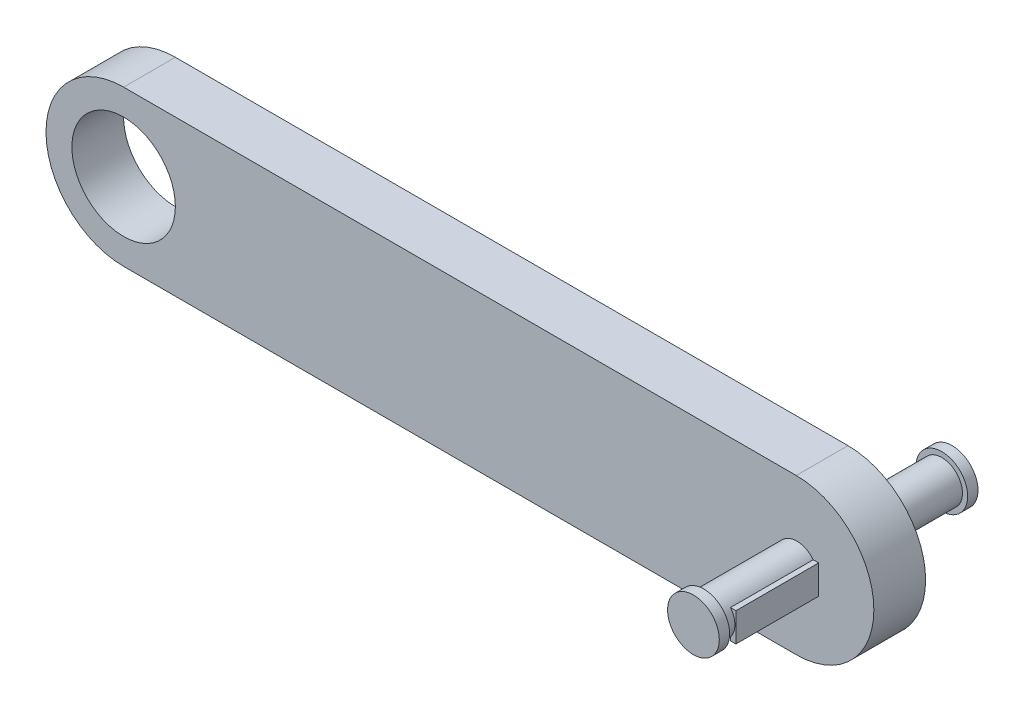
from build123d import *

# Parameters (mm, degrees)
SKETCH1_R                = 6.35
BOSS_EXTRUDE1_DEPTH      = 6.35
BOSS_EXTRUDE2_DEPTH      = 12.7
BOSS_EXTRUDE2_DEPTH_BACK = 19.05
SKETCH2_R                = 3.175
CUT_EXTRUDE1_START       = -1.27
SKETCH9_OUTSIDE_W        = 125.228
SKETCH9_OUTSIDE_H        = 42.678
SKETCH9_OUTSIDE_R        = 2.547934527
CUT_EXTRUDE1_DEPTH       = 11.43
CUT_EXTRUDE2_START       = -1.27
SKETCH10_OUTSIDE_W       = 125.228
SKETCH10_OUTSIDE_H       = 42.678
SKETCH10_OUTSIDE_R       = 2.542549773
CUT_EXTRUDE2_DEPTH       = 11.43
SKETCH11_W               = 0.667064712
SKETCH11_H               = 3.541255891
BOSS_EXTRUDE3_DEPTH      = 10.16


with BuildPart() as part:
    # Sketch1 → Boss-Extrude1 (new body)
    with BuildSketch(Plane.XY):
        with BuildLine():
            Line((-75.85152439, 14.055182927), (6.69847561, 14.055182927))
            ThreePointArc((6.69847561, 14.055182927), (16.22347561, 4.530182927), (6.69847561, -4.994817073))
            Line((6.69847561, -4.994817073), (-75.85152439, -4.994817073))
            ThreePointArc((-75.85152439, -4.994817073), (-85.37652439, 4.530182927), (-75.85152439, 14.055182927))
        make_face()
        with Locations((-75.85152439, 4.530182927)):
            Circle(SKETCH1_R, mode=Mode.SUBTRACT)
    extrude(amount=BOSS_EXTRUDE1_DEPTH)

    # Sketch2 → Boss-Extrude2 (add, two sides: drawn at the far end of the back side and taken through both)
    with BuildSketch(Plane.XY.offset(6.35).offset(-BOSS_EXTRUDE2_DEPTH_BACK)):
        with Locations((6.779432591, 4.575242679)):
            Circle(SKETCH2_R)
    extrude(amount=BOSS_EXTRUDE2_DEPTH + BOSS_EXTRUDE2_DEPTH_BACK)

    # Sketch9 outside → Cut-Extrude1 (cut)
    with BuildSketch(Plane.XY.offset(19.05).offset(CUT_EXTRUDE1_START)):
        with Locations((-34.577, 4.53)):
            Rectangle(SKETCH9_OUTSIDE_W, SKETCH9_OUTSIDE_H)
        with Locations((6.779432591, 4.575242679)):
            Circle(SKETCH9_OUTSIDE_R, mode=Mode.SUBTRACT)
    extrude(amount=-CUT_EXTRUDE1_DEPTH, mode=Mode.SUBTRACT)

    # Sketch10 outside → Cut-Extrude2 (cut)
    with BuildSketch(Plane(origin=(0, 0, -12.7), x_dir=(-1, 0, 0), z_dir=(0, 0, -1)).offset(CUT_EXTRUDE2_START)):
        with Locations((34.577, 4.53)):
            Rectangle(SKETCH10_OUTSIDE_W, SKETCH10_OUTSIDE_H)
        with Locations((-6.779432591, 4.575242679)):
            Circle(SKETCH10_OUTSIDE_R, mode=Mode.SUBTRACT)
    extrude(amount=-CUT_EXTRUDE2_DEPTH, mode=Mode.SUBTRACT)

    # Sketch11 → Boss-Extrude3 (add)
    with BuildSketch(Plane.XY.offset(6.35)):
        with Locations((9.121178525, 4.372750116)):
            Rectangle(SKETCH11_W, SKETCH11_H)
    extrude(amount=BOSS_EXTRUDE3_DEPTH)


solid = part.part
